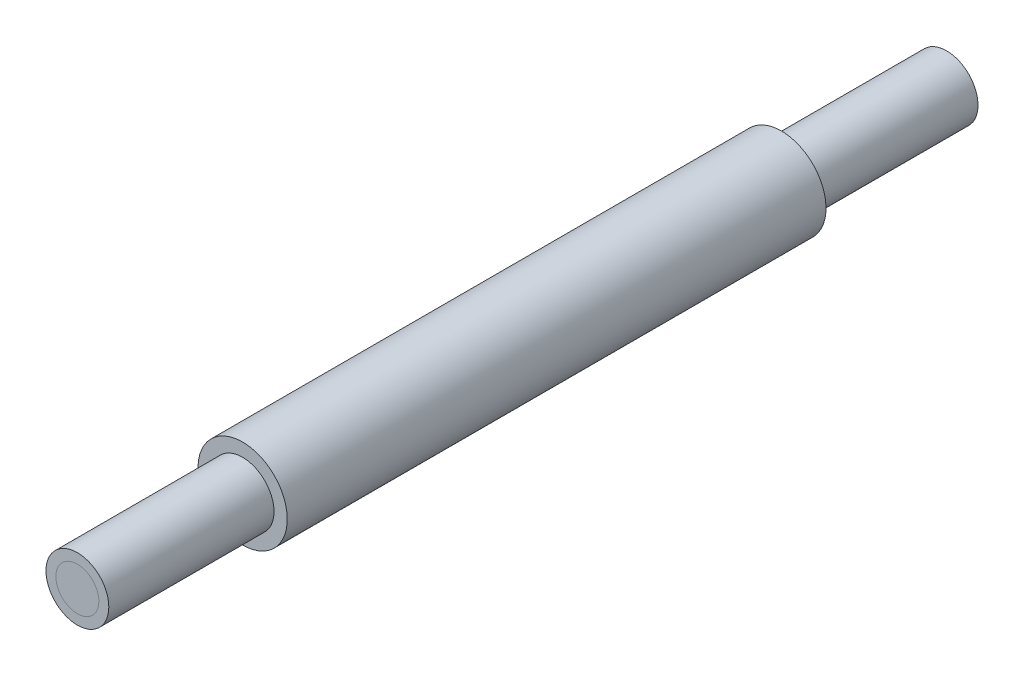
from build123d import *
from OCP.BRepFilletAPI import BRepFilletAPI_MakeChamfer

# Parameters (mm, degrees)
CHAMFER1_SIZE  = 0.03
CHAMFER1_SIZE2 = 0.000130901


with BuildPart() as part:
    # Sketch2 → Revolve1 (revolve)
    with BuildSketch(Plane(origin=(0, 0, 0), x_dir=(0, 0, -1), z_dir=(1, 0, 0)), mode=Mode.PRIVATE) as revolve1_sk:
        Polygon((-1.315, 0), (-1.315, 0.095), (-0.815, 0.095), (-0.815, 0.135), (0.815, 0.135), (0.815, 0.095), (1.315, 0.095), (1.315, 0), align=None)
    revolve(revolve1_sk.sketch.rotate(Axis((0, 0, 1.315), (0, 0, -1)), 180), axis=Axis((0, 0, 1.315), (0, 0, -1)))

    # Chamfer1: one chamfer whose edges measure the first distance from different faces: ONE call of the kernel's chamfer builder (chamfer() names one face for all edges)
    chamfer1_edges_1 = [part.edges().sort_by_distance(p)[0] for p in [
        (0, 0.095, 1.315),
    ]]
    chamfer1_side_1 = [part.faces().sort_by_distance(p)[0] for p in [
        (0, 0, 1.315),
    ]]
    chamfer1_edges_2 = [part.edges().sort_by_distance(p)[0] for p in [
        (0, 0.095, -1.315),
    ]]
    chamfer1_side_2 = [part.faces().sort_by_distance(p)[0] for p in [
        (0, 0, -1.315),
    ]]
    chamfer1 = BRepFilletAPI_MakeChamfer(part.part.solid().wrapped)
    for e in chamfer1_edges_1:
        chamfer1.Add(CHAMFER1_SIZE, CHAMFER1_SIZE2, e.wrapped, chamfer1_side_1[0].wrapped)  # the first distance lies on this face
    for e in chamfer1_edges_2:
        chamfer1.Add(CHAMFER1_SIZE, CHAMFER1_SIZE2, e.wrapped, chamfer1_side_2[0].wrapped)  # the first distance lies on this face
    add(Compound.cast(chamfer1.Shape()), mode=Mode.REPLACE)


solid = part.part
